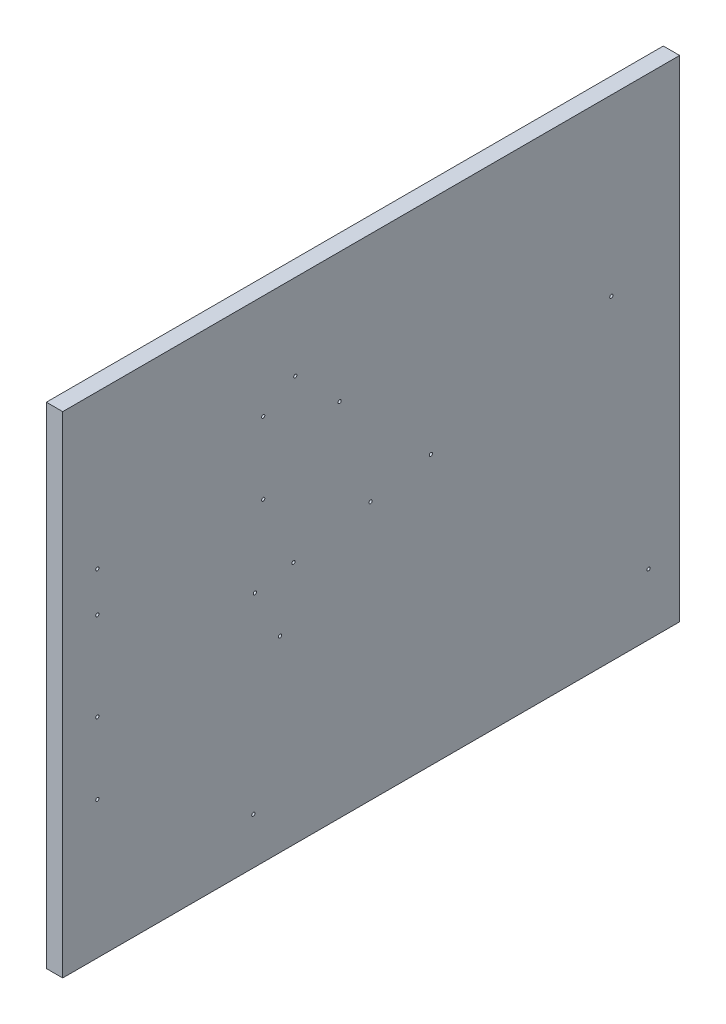
from build123d import *

# Parameters (mm, degrees)
SKETCH_1_W               = 566.00530096
SKETCH_1_H               = 450
EXTRUDE_1_DEPTH          = 15
SKETCH_3_R               = 4
CUT_EXTRUDE_1_DEPTH      = 10
CUT_EXTRUDE_2_DEPTH      = 650.088721912
CUT_EXTRUDE_2_DEPTH_BACK = 650.088721912
SKETCH_4_R               = 1.5


with BuildPart() as part:
    # Эскиз1 → Бобышка-Вытянуть1 (new body)
    with BuildSketch(Plane(origin=(0, 0, 0), x_dir=(0, 0, -1), z_dir=(1, 0, 0))):
        with Locations((208.480579539, 198.716182749)):
            Rectangle(SKETCH_1_W, SKETCH_1_H)
    extrude(amount=EXTRUDE_1_DEPTH)

    # Эскиз3 → Вырез-Вытянуть1 (cut)
    with BuildSketch(Plane.ZY):
        with Locations((-459.121136887, 408.987044781)):
            Circle(SKETCH_3_R)
    extrude(amount=-CUT_EXTRUDE_1_DEPTH, mode=Mode.SUBTRACT)

    # Эскиз4 → Вырез-Вытянуть2 (cut, two sides: drawn at the far end of the back side and taken through both)
    with BuildSketch(Plane.ZY.offset(-CUT_EXTRUDE_2_DEPTH_BACK)):
        with Locations((-138.909883055, 345.235633328)):
            Circle(SKETCH_4_R)
        with Locations((-179.495629652, 304.64988673)):
            Circle(SKETCH_4_R)
        with Locations((-263.2761242, 220.869392183)):
            Circle(SKETCH_4_R)
        with Locations((-207.931126478, 210.859443585)):
            Circle(SKETCH_4_R)
        with Locations((-137.119879485, 197.982216734)):
            Circle(SKETCH_4_R)
        with Locations((42.714652053, 165.278795224)):
            Circle(SKETCH_4_R)
        with Locations((-124.831154964, 145.715565594)):
            Circle(SKETCH_4_R)
        with Locations((42.714652053, 99.692621204)):
            Circle(SKETCH_4_R)
        with Locations((-100.410954005, 16.360792756)):
            Circle(SKETCH_4_R)
        with Locations((-101.789718427, 191.557326369)):
            Circle(SKETCH_4_R)
        with Locations((42.714652053, 246.301380308)):
            Circle(SKETCH_4_R)
        with Locations((-428.821301923, 263.704028896)):
            Circle(SKETCH_4_R)
        with Locations((42.714652053, 282.872517245)):
            Circle(SKETCH_4_R)
        with Locations((-109.444727657, 262.061630053)):
            Circle(SKETCH_4_R)
        with Locations((-109.444727657, 327.974766948)):
            Circle(SKETCH_4_R)
        with Locations((-463.012887704, 29.966051081)):
            Circle(SKETCH_4_R)
    extrude(amount=CUT_EXTRUDE_2_DEPTH + CUT_EXTRUDE_2_DEPTH_BACK, mode=Mode.SUBTRACT)


solid = part.part
